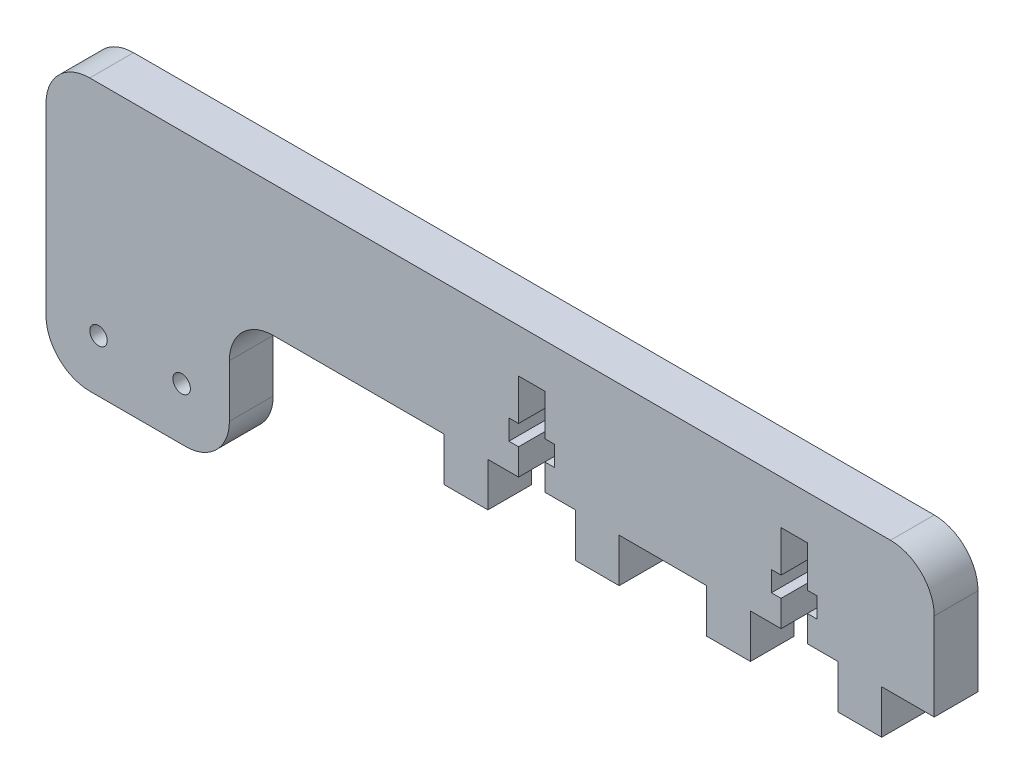
from build123d import *

# Parameters (mm, degrees)
ESQUISSE1_R        = 1
BOSS_EXTRU_1_DEPTH = 5
CONG_1_R           = 5


with BuildPart() as part:
    # Esquisse1 → Boss.-Extru.1 (new body)
    with BuildSketch(Plane.XY):
        Polygon((-16.5, 0), (-20, 0), (-20, -5), (-25, -5), (-25, 0), (-49.542451618, 0), (-49.542451618, -16), (-70.5, -16), (-70.5, 0), (-70.5, 15), (31.001104841, 15), (31.001104841, 0), (25, 0), (25, -5), (20, -5), (20, 0), (16.5, 0), (16.5, 3), (17.6, 3), (17.6, 5.3), (16.5, 5.3), (16.5, 10), (13.5, 10), (13.5, 5.3), (12.4, 5.3), (12.4, 3), (13.5, 3), (13.5, 0), (10, 0), (10, -5), (5, -5), (5, 0), (-5, 0), (-5, -5), (-10, -5), (-10, 0), (-13.5, 0), (-13.5, 3), (-12.4, 3), (-12.4, 5.3), (-13.5, 5.3), (-13.5, 10), (-16.5, 10), (-16.5, 5.3), (-17.6, 5.3), (-17.6, 3), (-16.5, 3), align=None)
        with Locations((-64.5, -10)):
            Circle(ESQUISSE1_R, mode=Mode.SUBTRACT)
        with Locations((-55, -10)):
            Circle(ESQUISSE1_R, mode=Mode.SUBTRACT)
    extrude(amount=BOSS_EXTRU_1_DEPTH)

    # Congé1
    cong_1_edges = [part.edges().sort_by_distance(p)[0] for p in [
        (-49.542451618, 0, 2.5),
        (-49.542451618, -16, 2.5),
        (-70.5, -16, 2.5),
        (-70.5, 15, 2.5),
        (31.001104841, 15, 2.5),
    ]]
    fillet(cong_1_edges, radius=CONG_1_R)


solid = part.part
